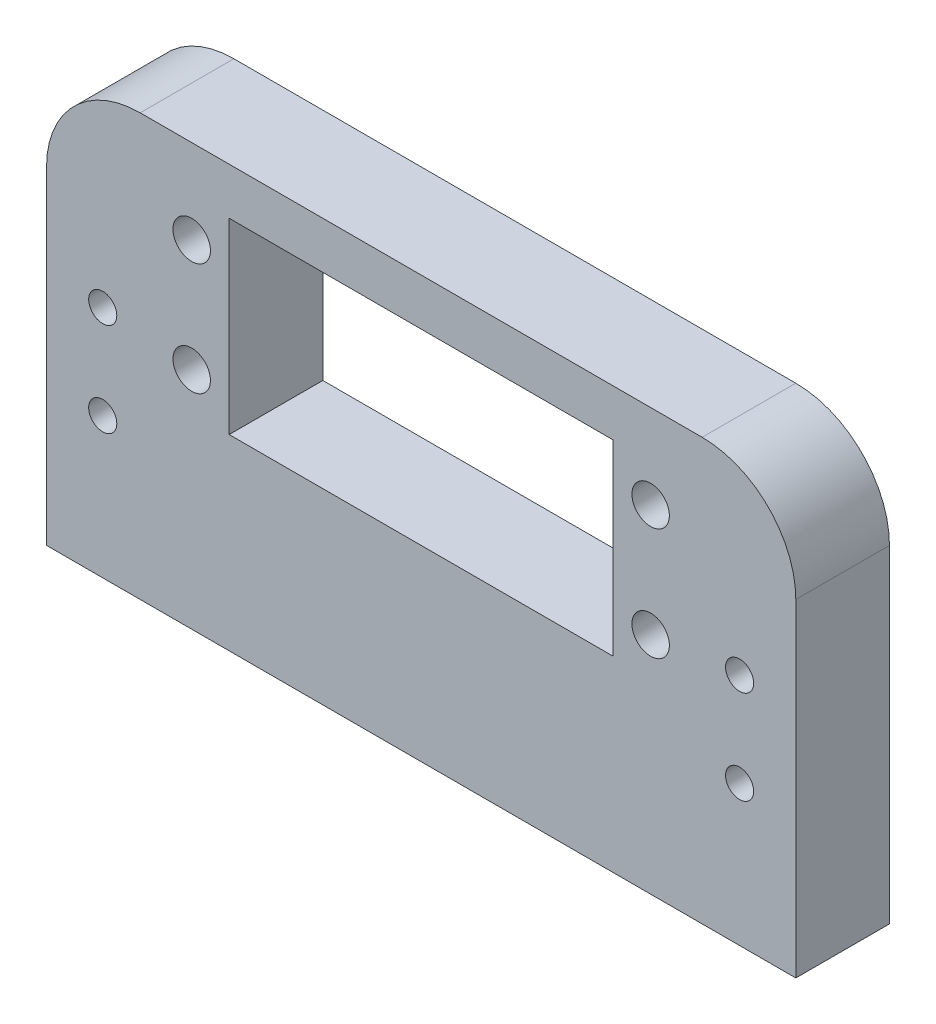
from build123d import *

# Parameters (mm, degrees)
SKETCH1_R           = 2
SKETCH1_R_2         = 1.5
SKETCH1_W           = 41
SKETCH1_H           = 20
BOSS_EXTRUDE1_DEPTH = 10


with BuildPart() as part:
    # Sketch1 → Boss-Extrude1 (new body)
    with BuildSketch(Plane.XY):
        with BuildLine():
            Line((-15.536480687, 29.570815451), (44.463519313, 29.570815451))
            ThreePointArc((44.463519313, 29.570815451), (51.534587125, 26.641883263), (54.463519313, 19.570815451))
            Line((54.463519313, 19.570815451), (54.463519313, -15.429184549))
            Line((54.463519313, -15.429184549), (-25.536480687, -15.429184549))
            Line((-25.536480687, -15.429184549), (-25.536480687, 19.570815451))
            ThreePointArc((-25.536480687, 19.570815451), (-22.607548499, 26.641883263), (-15.536480687, 29.570815451))
        make_face()
        with Locations((-10.036480687, 20.570815451)):
            Circle(SKETCH1_R, mode=Mode.SUBTRACT)
        with Locations((38.963519313, 8.570815451)):
            Circle(SKETCH1_R, mode=Mode.SUBTRACT)
        with Locations(Location((-10.036480687, 8.570815451, 0), (0, 0, 180))):
            Circle(SKETCH1_R, mode=Mode.SUBTRACT)
        with Locations(Location((38.963519313, 20.570815451, 0), (0, 0, 180))):
            Circle(SKETCH1_R, mode=Mode.SUBTRACT)
        with Locations((-19.536480687, -0.429184549)):
            Circle(SKETCH1_R_2, mode=Mode.SUBTRACT)
        with Locations((-19.536480687, 9.570815451)):
            Circle(SKETCH1_R_2, mode=Mode.SUBTRACT)
        with Locations(Location((48.463519313, 9.570815451, 0), (0, 0, 180))):
            Circle(SKETCH1_R_2, mode=Mode.SUBTRACT)
        with Locations(Location((48.463519313, -0.429184549, 0), (0, 0, 180))):
            Circle(SKETCH1_R_2, mode=Mode.SUBTRACT)
        with Locations((14.463519313, 14.570815451)):
            Rectangle(SKETCH1_W, SKETCH1_H, mode=Mode.SUBTRACT)
    extrude(amount=BOSS_EXTRUDE1_DEPTH)


solid = part.part
